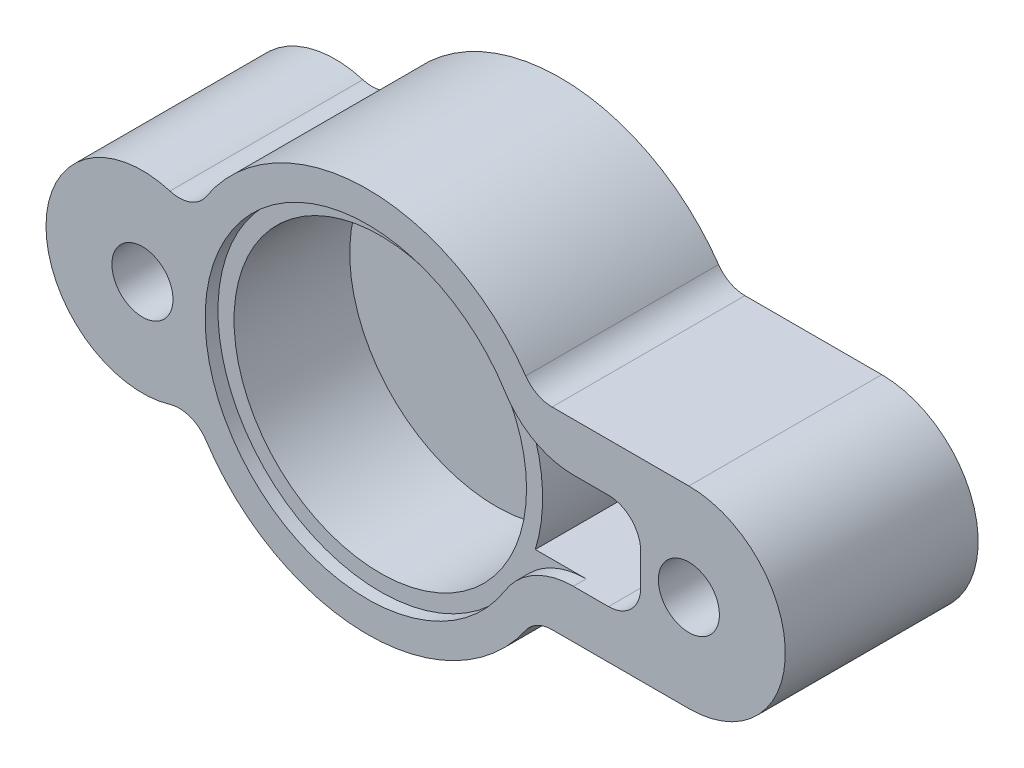
from build123d import *

# Parameters (mm, degrees)
BOSS_EXTRU_1_DEPTH      = 12
ESQUISSE2_R             = 9.1
ENL_V_MAT_EXTRU_3_DEPTH = 8
ENL_V_MAT_EXTRU_4_DEPTH = 6
ENL_V_MAT_EXTRU_5_DEPTH = 0.8
BOSS_EXTRU_2_DEPTH      = 12
ESQUISSE6_R             = 1.9
ENL_V_MAT_EXTRU_6_DEPTH = 10
CONG_1_R                = 5
CONG_2_R                = 2


with BuildPart() as part:
    # Esquisse1 → Boss.-Extru.1 (new body)
    with BuildSketch(Plane.XY):
        with BuildLine():
            Line((10.392304845, 6), (20, 6))
            Line((20, 6), (20, -6))
            Line((20, -6), (10.392304845, -6))
            ThreePointArc((10.392304845, -6), (-12, 0), (10.392304845, 6))
        make_face()
    extrude(amount=BOSS_EXTRU_1_DEPTH)

    # Esquisse2 → Enlèv. mat.-Extru.3 (cut)
    with BuildSketch(Plane.XY.offset(12)):
        Circle(ESQUISSE2_R)
    extrude(amount=-ENL_V_MAT_EXTRU_3_DEPTH, mode=Mode.SUBTRACT)

    # Esquisse3 → Enlèv. mat.-Extru.4 (cut)
    with BuildSketch(Plane.XY.offset(12)):
        with BuildLine():
            Line((9.644169223, 3), (17, 3))
            Line((17, 3), (17, -3))
            Line((17, -3), (9.644169223, -3))
            ThreePointArc((9.644169223, -3), (10.1, 0), (9.644169223, 3))
        make_face()
    extrude(amount=-ENL_V_MAT_EXTRU_4_DEPTH, mode=Mode.SUBTRACT)

    # Esquisse4 → Enlèv. mat.-Extru.5 (cut)
    with BuildSketch(Plane.XY.offset(12)):
        with BuildLine():
            Line((17, -3), (17, 3))
            Line((17, 3), (9.644169223, 3))
            ThreePointArc((9.644169223, 3), (-10.1, 0), (9.644169223, -3))
            Line((9.644169223, -3), (17, -3))
        make_face()
    extrude(amount=-ENL_V_MAT_EXTRU_5_DEPTH, mode=Mode.SUBTRACT)

    # Esquisse5 → Boss.-Extru.2 (add)
    with BuildSketch(Plane.XY.offset(12)):
        with BuildLine():
            Line((20, 6), (20, -6))
            ThreePointArc((20, -6), (26, 0), (20, 6))
        make_face()
        with BuildLine():
            Line((-10.857142857, 5.11101252), (-10.857142857, -5.11101252))
            ThreePointArc((-10.857142857, -5.11101252), (-20, 0), (-10.857142857, 5.11101252))
        make_face()
    extrude(amount=-BOSS_EXTRU_2_DEPTH)

    # Esquisse6 → Enlèv. mat.-Extru.6 (cut)
    with BuildSketch(Plane.XY.offset(12)):
        with Locations((-14, 0)):
            Circle(ESQUISSE6_R)
        with Locations((20, 0)):
            Circle(ESQUISSE6_R)
    extrude(amount=-ENL_V_MAT_EXTRU_6_DEPTH, mode=Mode.SUBTRACT)

    # Congé1
    cong_1_edges = [part.edges().sort_by_distance(p)[0] for p in [
        (9.644169223, 3, 11.6),
        (9.644169223, -3, 11.6),
    ]]
    fillet(cong_1_edges, radius=CONG_1_R)

    # Congé2
    cong_2_edges = [part.edges().sort_by_distance(p)[0] for p in [
        (17, 3, 9),
        (17, -3, 9),
        (-10.857142857, -5.11101252, 6),
        (-10.857142857, 5.11101252, 6),
        (10.392304845, 6, 6),
        (10.392304845, -6, 6),
    ]]
    fillet(cong_2_edges, radius=CONG_2_R)


solid = part.part
